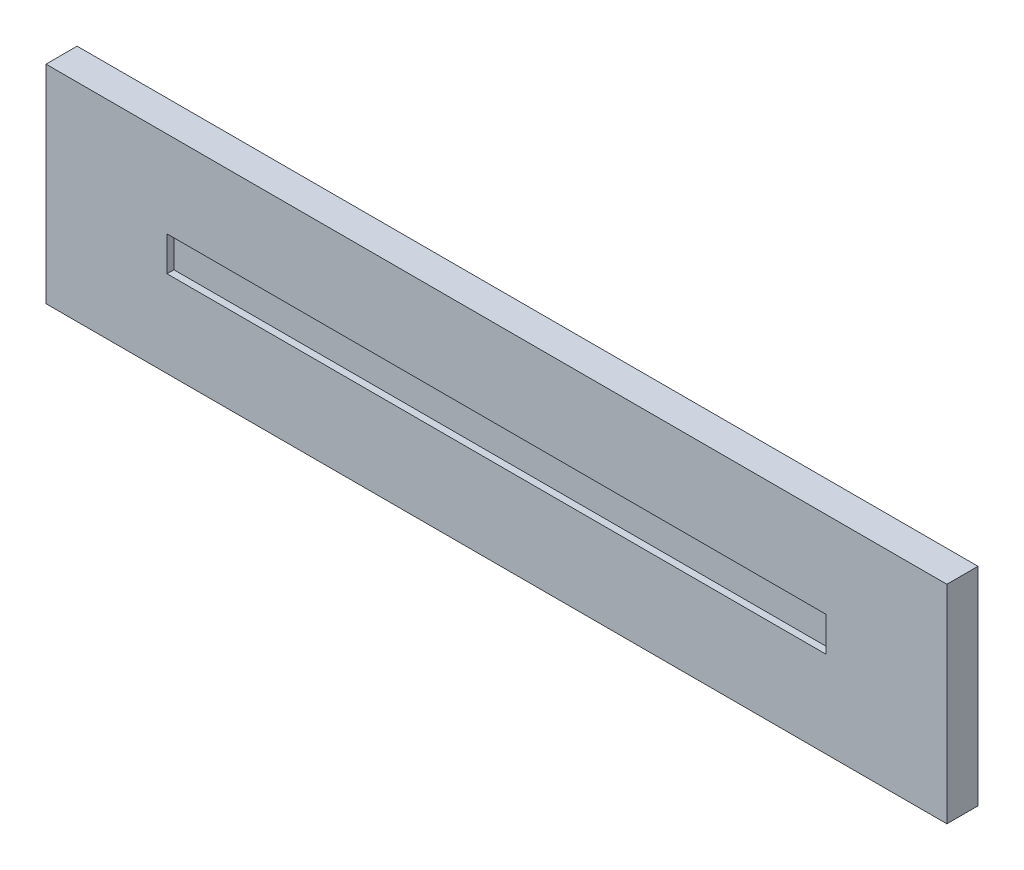
from build123d import *

# Parameters (mm, degrees)
SKETCH1_W           = 521
SKETCH1_H           = 120
BOSS_EXTRUDE1_DEPTH = 18
SKETCH2_W           = 381
SKETCH2_H           = 20
CUT_EXTRUDE1_DEPTH  = 4


with BuildPart() as part:
    # Sketch1 → Boss-Extrude1 (new body)
    with BuildSketch(Plane.XY):
        Rectangle(SKETCH1_W, SKETCH1_H)
    extrude(amount=BOSS_EXTRUDE1_DEPTH)

    # Sketch2 → Cut-Extrude1 (cut)
    with BuildSketch(Plane.XY.offset(18)):
        Rectangle(SKETCH2_W, SKETCH2_H)
    extrude(amount=-CUT_EXTRUDE1_DEPTH, mode=Mode.SUBTRACT)


solid = part.part
